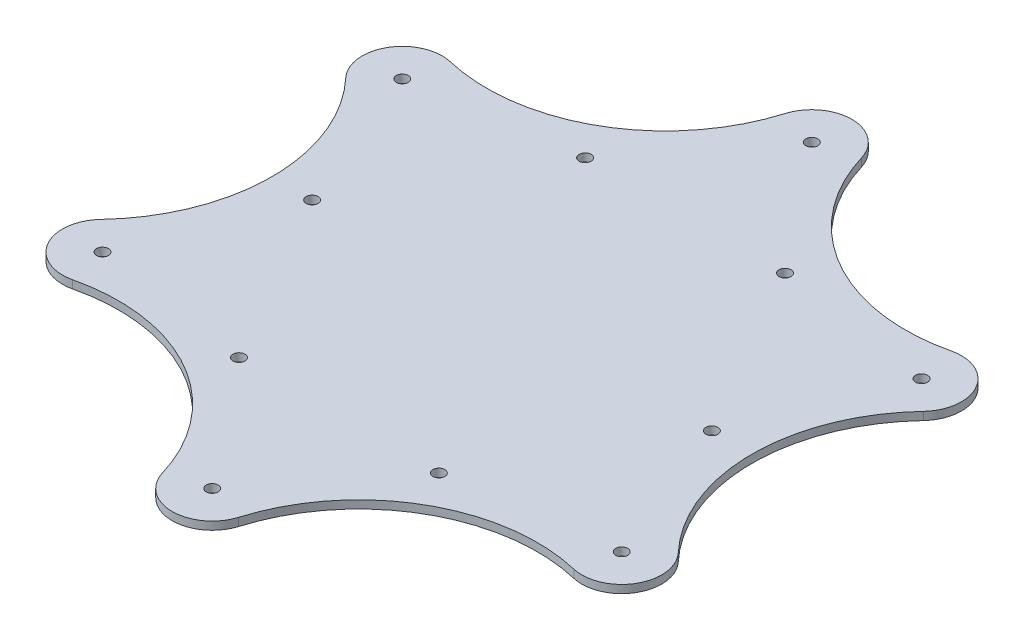
from build123d import *

# Parameters (mm, degrees)
SKETCH1_R           = 1.5
BOSS_EXTRUDE1_DEPTH = 2


with BuildPart() as part:
    # Sketch1 → Boss-Extrude1 (new body)
    with BuildSketch(Plane(origin=(0, 0, 0), x_dir=(1, 0, 0), z_dir=(0, 1, 0))):
        with BuildLine():
            ThreePointArc((9.564996236, 77.917335601), (0.016639307, 84.999986157), (-9.555234796, 77.949150385))
            ThreePointArc((-9.555234796, 77.949150385), (-30.018823636, 52.027506279), (-62.695893908, 47.242197528))
            ThreePointArc((-62.695893908, 47.242197528), (-73.603827679, 42.514403141), (-72.283561835, 30.69949912))
            ThreePointArc((-72.283561835, 30.69949912), (-60.066553951, 0.016689279), (-72.260890144, -30.675138073))
            ThreePointArc((-72.260890144, -30.675138073), (-73.620466987, -42.485583015), (-62.728327039, -47.249651265))
            ThreePointArc((-62.728327039, -47.249651265), (-30.047730315, -52.010817), (-9.564996236, -77.917335601))
            ThreePointArc((-9.564996236, -77.917335601), (-0.016639307, -84.999986157), (9.555234796, -77.949150385))
            ThreePointArc((9.555234796, -77.949150385), (30.018823636, -52.027506279), (62.695893908, -47.242197528))
            ThreePointArc((62.695893908, -47.242197528), (73.603827679, -42.514403141), (72.283561835, -30.69949912))
            ThreePointArc((72.283561835, -30.69949912), (60.066553951, -0.016689279), (72.260890144, 30.675138073))
            ThreePointArc((72.260890144, 30.675138073), (73.620466987, 42.485583015), (62.728327039, 47.249651265))
            ThreePointArc((62.728327039, 47.249651265), (30.047730315, 52.010817), (9.564996236, 77.917335601))
        make_face()
        with Locations(Location((-64.951905284, -37.5, 0), (0, 0, 90))):
            Circle(SKETCH1_R, mode=Mode.SUBTRACT)
        with Locations(Location((0, 75, 0), (0, 0, 90))):
            Circle(SKETCH1_R, mode=Mode.SUBTRACT)
        with Locations(Location((-25, 43.301270189, 0), (0, 0, 90))):
            Circle(SKETCH1_R, mode=Mode.SUBTRACT)
        with Locations(Location((-64.951905284, 37.5, 0), (0, 0, 90))):
            Circle(SKETCH1_R, mode=Mode.SUBTRACT)
        with Locations(Location((64.951905284, 37.5, 0), (0, 0, 90))):
            Circle(SKETCH1_R, mode=Mode.SUBTRACT)
        with Locations(Location((64.951905284, -37.5, 0), (0, 0, 90))):
            Circle(SKETCH1_R, mode=Mode.SUBTRACT)
        with Locations(Location((25, 43.301270189, 0), (0, 0, 90))):
            Circle(SKETCH1_R, mode=Mode.SUBTRACT)
        with Locations(Location((0, -75, 0), (0, 0, 90))):
            Circle(SKETCH1_R, mode=Mode.SUBTRACT)
        with Locations(Location((-50, 0, 0), (0, 0, 90))):
            Circle(SKETCH1_R, mode=Mode.SUBTRACT)
        with Locations(Location((25, -43.301270189, 0), (0, 0, 90))):
            Circle(SKETCH1_R, mode=Mode.SUBTRACT)
        with Locations(Location((-25, -43.301270189, 0), (0, 0, 90))):
            Circle(SKETCH1_R, mode=Mode.SUBTRACT)
        with Locations(Location((50, 0, 0), (0, 0, 90))):
            Circle(SKETCH1_R, mode=Mode.SUBTRACT)
    extrude(amount=BOSS_EXTRUDE1_DEPTH)


solid = part.part
